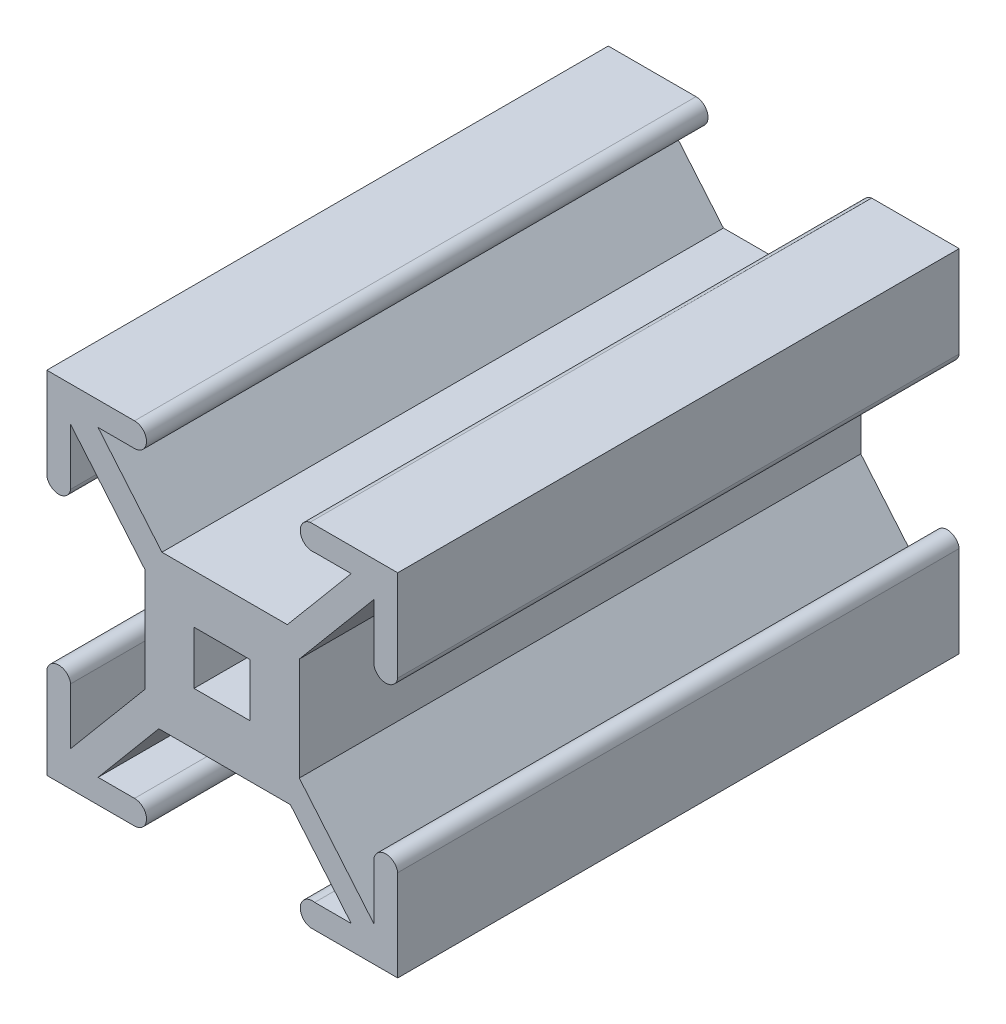
from build123d import *

# Parameters (mm, degrees)
SKETCH1_W           = 50
SKETCH1_H           = 50
BOSS_EXTRUDE1_DEPTH = 80
SKETCH2_W           = 18
SKETCH2_H           = 18
CUT_EXTRUDE2_DEPTH  = 287
SKETCH3_OUTSIDE_W   = 73.354
SKETCH3_OUTSIDE_H   = 73.354
CUT_EXTRUDE5_DEPTH  = 287
SKETCH4_W           = 18
SKETCH4_H           = 18
BOSS_EXTRUDE2_DEPTH = 80
SKETCH5_W           = 8
SKETCH5_H           = 7.553245746
CUT_EXTRUDE6_DEPTH  = 250


with BuildPart() as part:
    # Sketch1 → Boss-Extrude1 (new body)
    with BuildSketch(Plane.XY):
        with Locations((3.9408867, 0)):
            Rectangle(SKETCH1_W, SKETCH1_H)
    extrude(amount=BOSS_EXTRUDE1_DEPTH)

    # Sketch2 → Cut-Extrude2 (cut)
    with BuildSketch(Plane(origin=(0, 0, 0), x_dir=(-1, 0, 0), z_dir=(0, 0, -1))):
        with Locations((-3.9408867, 0)):
            Rectangle(SKETCH2_W, SKETCH2_H)
    extrude(amount=-CUT_EXTRUDE2_DEPTH, mode=Mode.SUBTRACT)

    # Sketch3 outside → Cut-Extrude5 (cut)
    with BuildSketch(Plane(origin=(0, 0, 0), x_dir=(-1, 0, 0), z_dir=(0, 0, -1))):
        with Locations((-3.941, 0)):
            Rectangle(SKETCH3_OUTSIDE_W, SKETCH3_OUTSIDE_H)
        with BuildLine():
            Line((-22.316271067, 21.584230763), (-17.116271067, 21.584230763))
            ThreePointArc((-17.116271067, 21.584230763), (-15.082817857, 22.96654679), (-16.465133883, 25))
            Line((-16.465133883, 25), (-28.9408867, 25))
            Line((-28.9408867, 25), (-28.9408867, 12.5))
            ThreePointArc((-28.9408867, 12.5), (-27.489165976, 10.551720724), (-25.5408867, 12.003441448))
            Line((-25.5408867, 12.003441448), (-25.5408867, 20.003441448))
            Line((-25.5408867, 20.003441448), (-18.539469589, 11.659477453))
            Line((-18.539469589, 11.659477453), (-14.917465737, 7.34294135))
            Line((-14.917465737, 7.34294135), (-14.917465737, -7.34294135))
            Line((-14.917465737, -7.34294135), (-18.539469589, -11.659477453))
            Line((-18.539469589, -11.659477453), (-25.5408867, -20.003441448))
            Line((-25.5408867, -20.003441448), (-25.5408867, -12.003441448))
            ThreePointArc((-25.5408867, -12.003441448), (-27.489165976, -10.551720724), (-28.9408867, -12.5))
            Line((-28.9408867, -12.5), (-28.9408867, -25))
            Line((-28.9408867, -25), (-16.465133883, -25))
            ThreePointArc((-16.465133883, -25), (-15.082817857, -22.96654679), (-17.116271067, -21.584230763))
            Line((-17.116271067, -21.584230763), (-22.316271067, -21.584230763))
            Line((-22.316271067, -21.584230763), (-17.28167328, -15.584230763))
            Line((-17.28167328, -15.584230763), (-13.653142176, -11.259915785))
            Line((-13.653142176, -11.259915785), (5.089795616, -11.259915785))
            Line((5.089795616, -11.259915785), (8.71832672, -15.584230763))
            Line((8.71832672, -15.584230763), (13.752924507, -21.584230763))
            Line((13.752924507, -21.584230763), (8.5591133, -21.584230763))
            ThreePointArc((8.5591133, -21.584230763), (6.851228682, -23.292115382), (8.5591133, -25))
            Line((8.5591133, -25), (21.0591133, -25))
            Line((21.0591133, -25), (21.0591133, -12.5))
            ThreePointArc((21.0591133, -12.5), (19.607392577, -10.551720724), (17.6591133, -12.003441448))
            Line((17.6591133, -12.003441448), (17.6591133, -20.003441448))
            Line((17.6591133, -20.003441448), (10.65769619, -11.659477453))
            Line((10.65769619, -11.659477453), (7.035692338, -7.34294135))
            Line((7.035692338, -7.34294135), (7.035692338, 7.34294135))
            Line((7.035692338, 7.34294135), (10.65769619, 11.659477453))
            Line((10.65769619, 11.659477453), (17.6591133, 20.003441448))
            Line((17.6591133, 20.003441448), (17.6591133, 12.003441448))
            ThreePointArc((17.6591133, 12.003441448), (19.607392577, 10.551720724), (21.0591133, 12.5))
            Line((21.0591133, 12.5), (21.0591133, 25))
            Line((21.0591133, 25), (8.5591133, 25))
            ThreePointArc((8.5591133, 25), (6.851228682, 23.292115382), (8.5591133, 21.584230763))
            Line((8.5591133, 21.584230763), (13.752924507, 21.584230763))
            Line((13.752924507, 21.584230763), (8.71832672, 15.584230763))
            Line((8.71832672, 15.584230763), (4.653605138, 10.740084215))
            Line((4.653605138, 10.740084215), (-13.216951698, 10.740084215))
            Line((-13.216951698, 10.740084215), (-17.28167328, 15.584230763))
            Line((-17.28167328, 15.584230763), (-22.316271067, 21.584230763))
        make_face(mode=Mode.SUBTRACT)
    extrude(amount=-CUT_EXTRUDE5_DEPTH, mode=Mode.SUBTRACT)

    # Sketch4 → Boss-Extrude2 (add)
    with BuildSketch(Plane(origin=(0, 0, 0), x_dir=(-1, 0, 0), z_dir=(0, 0, -1))):
        with Locations((-3.9408867, 0)):
            Rectangle(SKETCH4_W, SKETCH4_H)
    extrude(amount=-BOSS_EXTRUDE2_DEPTH)

    # Sketch5 → Cut-Extrude6 (cut)
    with BuildSketch(Plane(origin=(0, 0, 0), x_dir=(-1, 0, 0), z_dir=(0, 0, -1))):
        with Locations((-3.917465737, 0)):
            Rectangle(SKETCH5_W, SKETCH5_H)
    extrude(amount=-CUT_EXTRUDE6_DEPTH, mode=Mode.SUBTRACT)


solid = part.part
